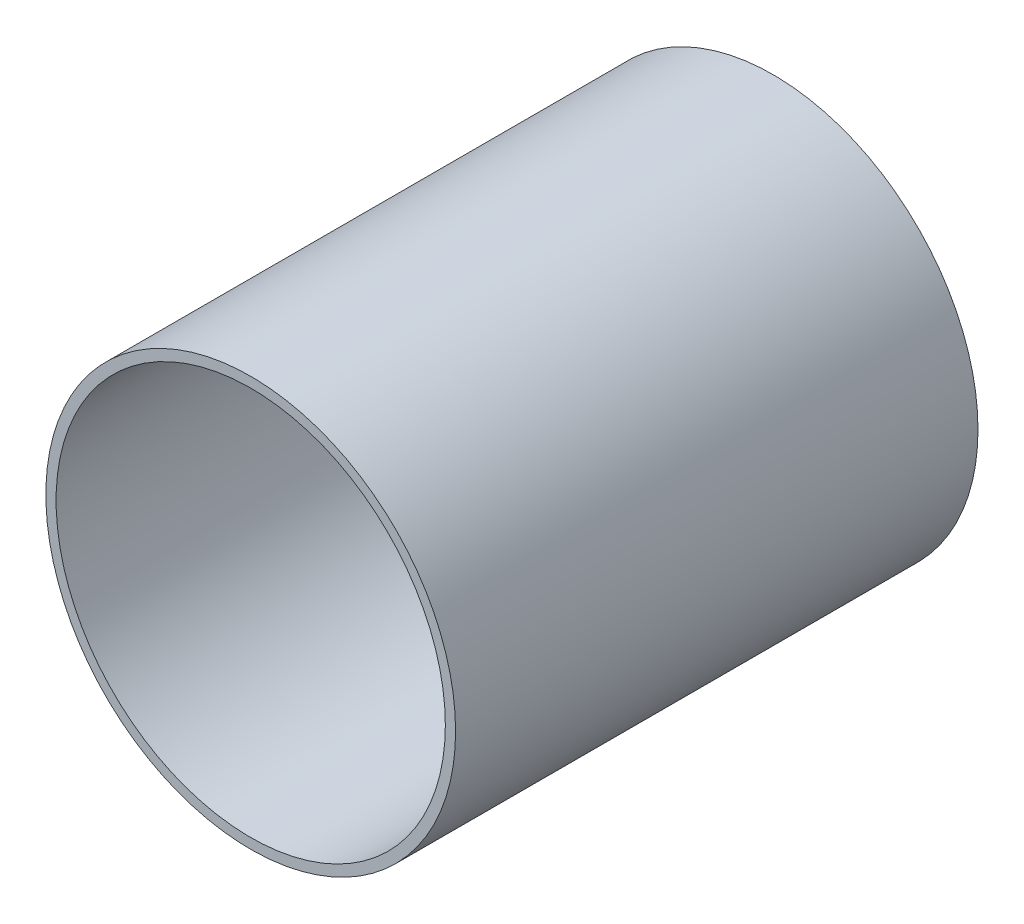
from build123d import *

# Parameters (mm, degrees)
SKETCH_1_R      = 10
SKETCH_1_R_2    = 9.5
EXTRUDE_1_DEPTH = 25.5


with BuildPart() as part:
    # 草图1 → 凸台-拉伸1 (new body)
    with BuildSketch(Plane.XY):
        Circle(SKETCH_1_R)
        Circle(SKETCH_1_R_2, mode=Mode.SUBTRACT)
    extrude(amount=EXTRUDE_1_DEPTH)


solid = part.part
